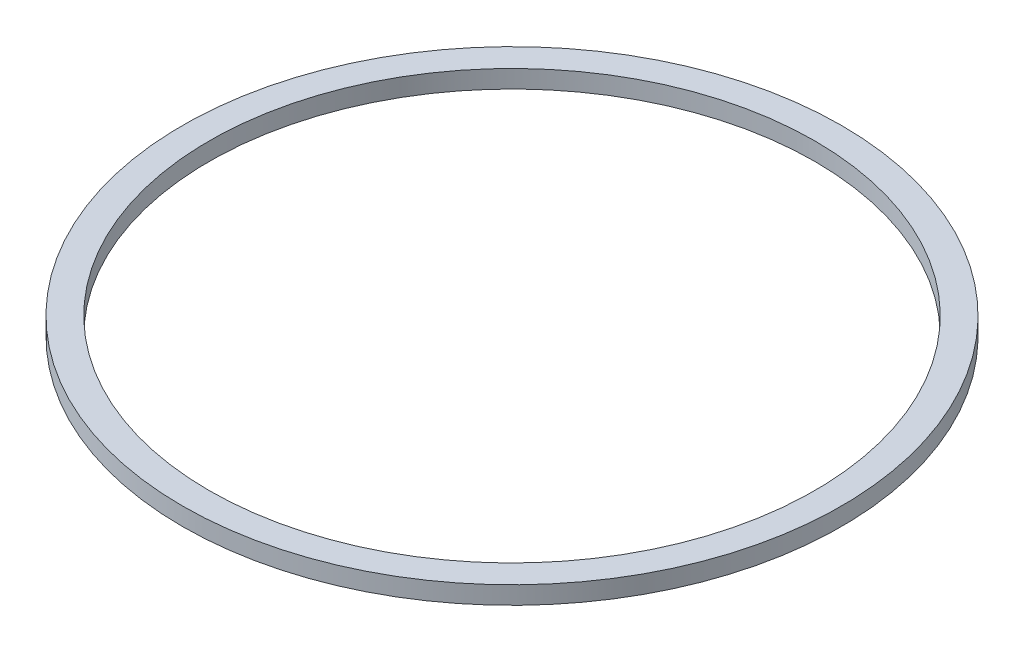
from build123d import *

# Parameters (mm, degrees)
SKETCH_1_R      = 185
SKETCH_1_R_2    = 170
EXTRUDE_1_DEPTH = 10


with BuildPart() as part:
    # 草图1 → 凸台-拉伸1 (new body)
    with BuildSketch(Plane(origin=(0, 0, 0), x_dir=(1, 0, 0), z_dir=(0, 1, 0))):
        with Locations(Location((0, 0, 0), (0, 0, 270))):
            Circle(SKETCH_1_R)
        with Locations(Location((0, 0, 0), (0, 0, 270))):
            Circle(SKETCH_1_R_2, mode=Mode.SUBTRACT)
    extrude(amount=EXTRUDE_1_DEPTH)


solid = part.part
